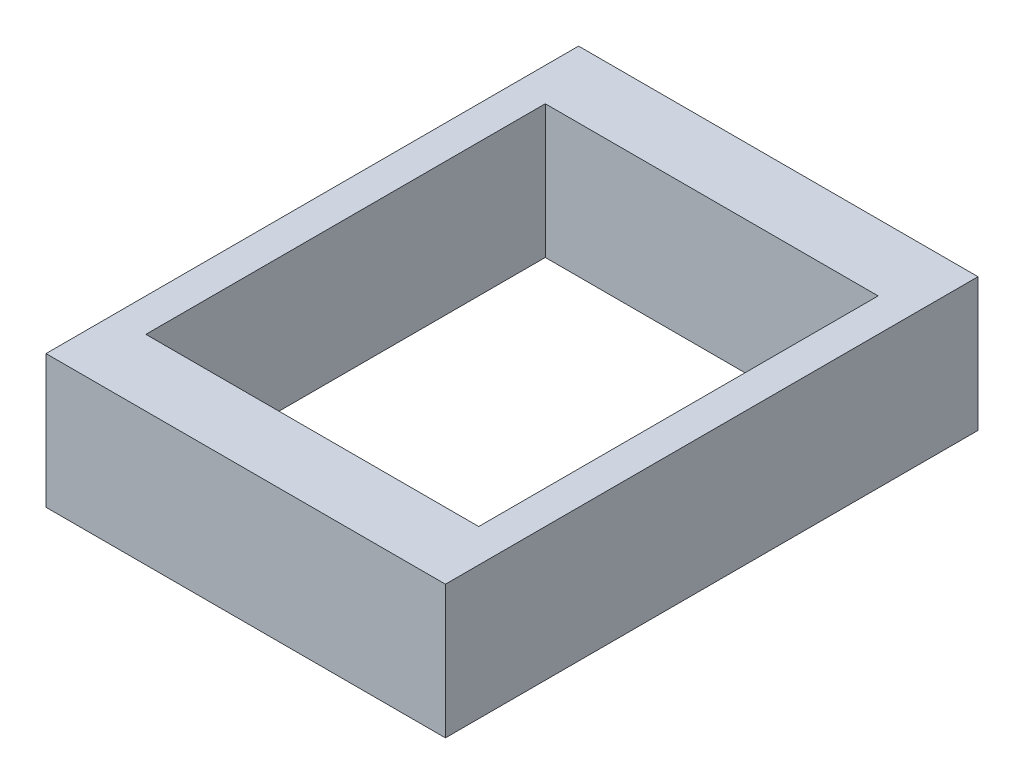
from build123d import *

# Parameters (mm, degrees)
SKETCH1_W           = 76.2
SKETCH1_H           = 101.6
BOSS_EXTRUDE1_DEPTH = 25.4
SKETCH2_W           = 63.5
SKETCH2_H           = 76.2
CUT_EXTRUDE1_DEPTH  = 69.391593051


with BuildPart() as part:
    # Sketch1 → Boss-Extrude1 (new body)
    with BuildSketch(Plane(origin=(0, 0, 0), x_dir=(1, 0, 0), z_dir=(0, 1, 0))):
        Rectangle(SKETCH1_W, SKETCH1_H)
    extrude(amount=BOSS_EXTRUDE1_DEPTH)

    # Sketch2 → Cut-Extrude1 (cut, through all)
    with BuildSketch(Plane(origin=(0, 25.4, 0), x_dir=(1, 0, 0), z_dir=(0, 1, 0))):
        Rectangle(SKETCH2_W, SKETCH2_H)
    extrude(amount=-CUT_EXTRUDE1_DEPTH, mode=Mode.SUBTRACT)


solid = part.part
